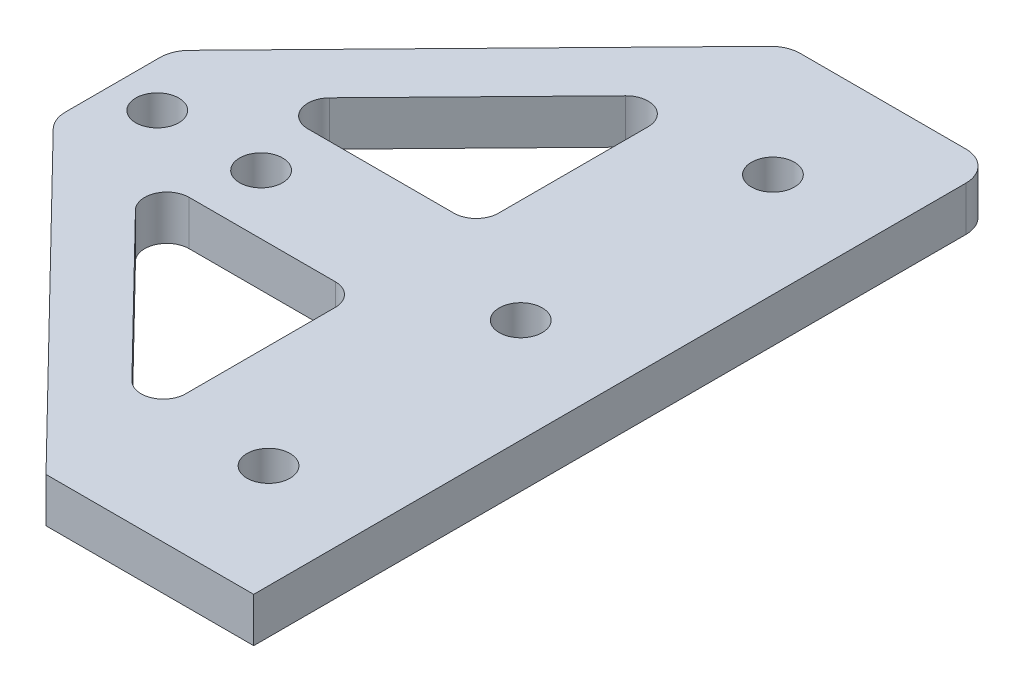
from build123d import *

# Parameters (mm, degrees)
EXTRUDE_1_DEPTH     = 3
SKETCH_2_W          = 14
SKETCH_2_H          = 50
EXTRUDE_2_DEPTH     = 3
SKETCH_3_R          = 1.45
CUT_EXTRUDE_1_DEPTH = 46.169126624
EXTRUDE_3_DEPTH     = 3
FILLET_1_R          = 1.5
FILLET_2_R          = 2


with BuildPart() as part:
    # 草图1 → 凸台-拉伸1 (new body)
    with BuildSketch(Plane(origin=(0, 0, 0), x_dir=(1, 0, 0), z_dir=(0, 1, 0))):
        with BuildLine():
            ThreePointArc((8.55, 4), (10, 5.45), (11.45, 4))
            Line((11.45, 4), (27.5, 4))
            Line((27.5, 4), (27.5, 8))
            Line((27.5, 8), (0, 8))
            Line((0, 8), (0, 4))
            Line((0, 4), (1.55, 4))
            ThreePointArc((1.55, 4), (3, 5.45), (4.45, 4))
            Line((4.45, 4), (8.55, 4))
        make_face()
        with BuildLine():
            Line((27.5, 4), (11.45, 4))
            ThreePointArc((11.45, 4), (10, 2.55), (8.55, 4))
            Line((8.55, 4), (4.45, 4))
            ThreePointArc((4.45, 4), (3, 2.55), (1.55, 4))
            Line((1.55, 4), (0, 4))
            Line((0, 4), (0, 0))
            Line((0, 0), (27.5, 0))
            Line((27.5, 0), (27.5, 4))
        make_face()
    extrude(amount=EXTRUDE_1_DEPTH)

    # 草图2 → 凸台-拉伸2 (add)
    with BuildSketch(Plane(origin=(0, 3, 0), x_dir=(1, 0, 0), z_dir=(0, 1, 0))):
        with Locations((27.5, 4)):
            Rectangle(SKETCH_2_W, SKETCH_2_H)
    extrude(amount=-EXTRUDE_2_DEPTH)

    # 草图3 → 切除-拉伸1 (cut, through all)
    with BuildSketch(Plane(origin=(0, 3, 0), x_dir=(1, 0, 0), z_dir=(0, 1, 0))):
        with Locations(Location((27.5, 21, 0), (0, 0, 270))):
            Circle(SKETCH_3_R)
        with Locations(Location((27.5, 4, 0), (0, 0, 270))):
            Circle(SKETCH_3_R)
        with Locations(Location((27.5, -13, 0), (0, 0, 270))):
            Circle(SKETCH_3_R)
    extrude(amount=-CUT_EXTRUDE_1_DEPTH, mode=Mode.SUBTRACT)

    # 草图4 → 凸台-拉伸3 (add)
    with BuildSketch(Plane(origin=(0, 3, 0), x_dir=(1, 0, 0), z_dir=(0, 1, 0))):
        Polygon((0, 8), (20.5, 29), (20.5, 23.27374416), (5.589916416, 8), align=None)
        Polygon((20.5, -21), (0, 0), (5.589916416, 0), (20.5, -15.27374416), align=None)
    extrude(amount=-EXTRUDE_3_DEPTH)

    # 圆角1
    fillet_1_edges = [part.edges().sort_by_distance(p)[0] for p in [
        (20.5, 1.5, 0),
        (20.5, 1.5, -8),
        (5.589916416, 1.5, -8),
        (20.5, 1.5, -23.27374416),
        (20.5, 1.5, 15.27374416),
        (5.589916416, 1.5, 0),
    ]]
    fillet(fillet_1_edges, radius=FILLET_1_R)

    # 圆角2
    fillet_2_edges = [part.edges().sort_by_distance(p)[0] for p in [
        (0, 1.5, -8),
        (0, 1.5, 0),
        (20.5, 1.5, -29),
        (34.5, 1.5, -29),
    ]]
    fillet(fillet_2_edges, radius=FILLET_2_R)


solid = part.part
